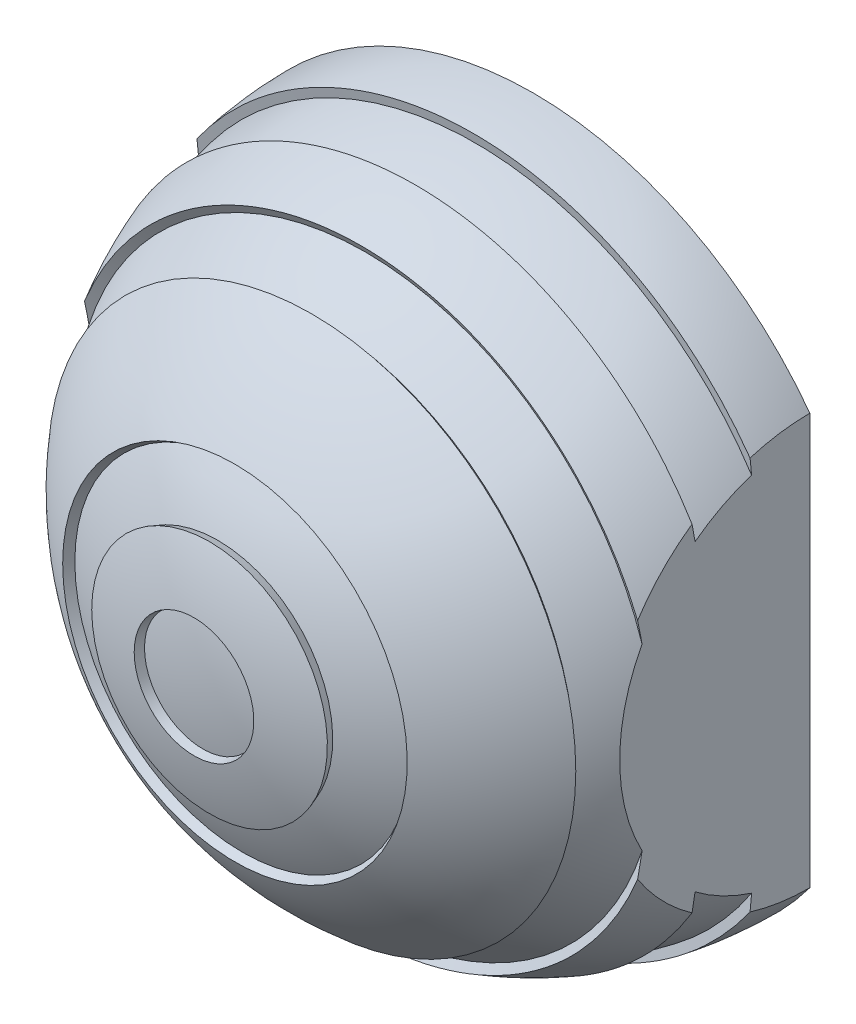
from build123d import *

# Parameters (mm, degrees)
REVOLVE_1_ANGLE     = 180
CUT_EXTRUDE_1_DEPTH = 44.56107781
SHELL_1_T           = -5
SKETCH_3_R          = 1.5
SKETCH_3_R_2        = 0.5
EXTRUDE_3_DEPTH     = 5
EXTRUDE_START       = 10
SKETCH_5_R          = 1.5
SKETCH_5_R_2        = 0.5
EXTRUDE_4_DEPTH     = 10


with BuildPart() as part:
    # 草图1 → 旋转1 (revolve)
    with BuildSketch(Plane.XY):
        with BuildLine():
            Line((0, 25.15), (0, -25.15))
            ThreePointArc((0, -25.15), (25.15, 0), (0, 25.15))
        make_face()
    revolve(axis=Axis((0, 25.15, 0), (0, -1, 0)), revolution_arc=REVOLVE_1_ANGLE)

    # 草图2 → 切除-拉伸1 (cut, through all)
    with BuildSketch(Plane(origin=(0, 0, 0), x_dir=(-1, 0, 0), z_dir=(0, 0, -1))):
        with BuildLine():
            ThreePointArc((25.15, 0), (23.877083587, 7.899834137), (20.18718653, 15))
            Line((20.18718653, 15), (20.18718653, -15))
            ThreePointArc((20.18718653, -15), (23.877083587, -7.899834137), (25.15, 0))
        make_face()
        with BuildLine():
            Line((-20.18718653, -15), (-20.18718653, 15))
            ThreePointArc((-20.18718653, 15), (-25.15, 0), (-20.18718653, -15))
        make_face()
    extrude(amount=-CUT_EXTRUDE_1_DEPTH, mode=Mode.SUBTRACT)

    # 抽壳1
    shell_1_openings = [part.faces().sort_by_distance(p)[0] for p in [
        (0, 0, 0),
    ]]
    offset(amount=SHELL_1_T, openings=shell_1_openings)

    # 草图3 → 凸台-拉伸3 (add)
    # profile 1 of 2: a face of its own
    with BuildSketch(Plane(origin=(0, 0, 0), x_dir=(-1, 0, 0), z_dir=(0, 0, -1))):
        with BuildLine():
            ThreePointArc((-15.18718653, 13.242804284), (0, 20.15), (15.18718653, 13.242804284))
            Line((15.18718653, 13.242804284), (15.18718653, -13.242804284))
            ThreePointArc((15.18718653, -13.242804284), (0, -20.15), (-15.18718653, -13.242804284))
            Line((-15.18718653, -13.242804284), (-15.18718653, 13.242804284))
        make_face()
        Circle(SKETCH_3_R, mode=Mode.SUBTRACT)
    # profile 2 of 2: a face of its own
    with BuildSketch(Plane(origin=(0, 0, 0), x_dir=(-1, 0, 0), z_dir=(0, 0, -1))):
        Circle(SKETCH_3_R)
        Circle(SKETCH_3_R_2, mode=Mode.SUBTRACT)
    extrude(amount=-EXTRUDE_3_DEPTH)

    # 草图5 → 凸台-拉伸4 (add)
    with BuildSketch(Plane(origin=(0, 0, 0), x_dir=(-1, 0, 0), z_dir=(0, 0, -1)).offset(EXTRUDE_START)):
        Circle(SKETCH_5_R)
        Circle(SKETCH_5_R_2, mode=Mode.SUBTRACT)
    extrude(amount=-EXTRUDE_4_DEPTH)

    # 草图6 → 切除-旋转2 (revolve, cut)
    with BuildSketch(Plane(origin=(0, 0, 0), x_dir=(0, 0, -1), z_dir=(1, 0, 0))):
        with BuildLine():
            ThreePointArc((-8.379493511, 23.022469209), (-6.341066605, 23.665182744), (-4.254380353, 24.127789949))
            Line((-4.254380353, 24.127789949), (-4.367251668, 24.767914988))
            ThreePointArc((-4.367251668, 24.767914988), (-6.509298984, 24.293034531), (-8.601806605, 23.633269413))
            Line((-8.601806605, 23.633269413), (-8.379493511, 23.022469209))
        make_face()
        with BuildLine():
            ThreePointArc((-15.748296437, 18.768088856), (-14.052622691, 20.069225085), (-12.25, 21.217622393))
            Line((-12.25, 21.217622393), (-12.575, 21.780538905))
            ThreePointArc((-12.575, 21.780538905), (-14.425447374, 20.601673914), (-16.166108384, 19.266017744))
            Line((-16.166108384, 19.266017744), (-15.748296437, 18.768088856))
        make_face()
        with BuildLine():
            ThreePointArc((-23.022469209, 8.379493511), (-22.204540782, 10.354147413), (-21.217622393, 12.25))
            Line((-21.217622393, 12.25), (-21.780538905, 12.575))
            ThreePointArc((-21.780538905, 12.575), (-22.793640844, 10.628849283), (-23.633269413, 8.601806605))
            Line((-23.633269413, 8.601806605), (-23.022469209, 8.379493511))
        make_face()
        with BuildLine():
            Line((-25.15, 0), (-24.5, 0))
            ThreePointArc((-24.5, 0), (-24.406770103, 2.135315697), (-24.127789949, 4.254380353))
            Line((-24.127789949, 4.254380353), (-24.767914988, 4.367251668))
            ThreePointArc((-24.767914988, 4.367251668), (-25.054296657, 2.19196693), (-25.15, 0))
        make_face()
    revolve(axis=Axis((0, 0, 0), (0, 0, 1)), mode=Mode.SUBTRACT)


solid = part.part
